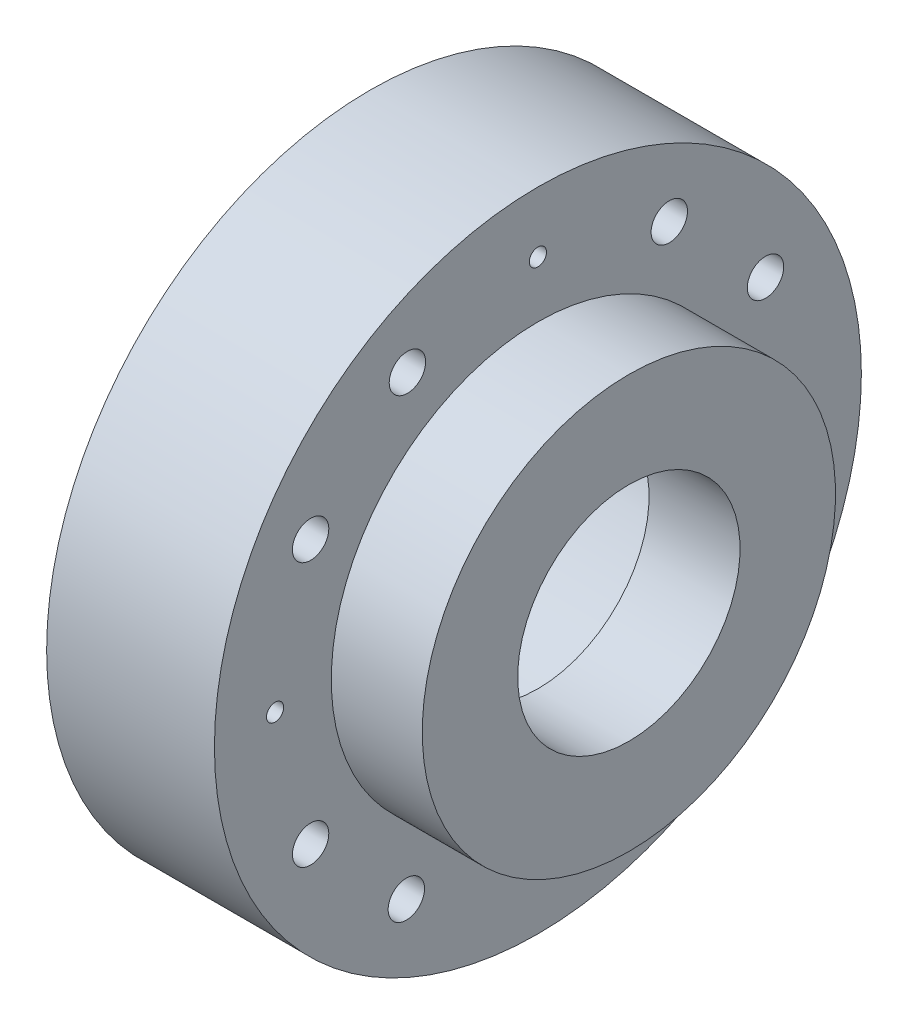
from build123d import *

# Parameters (mm, degrees)
ESQUISSE2_R             = 55
ENL_V_MAT_EXTRU_1_DEPTH = 242.016596939
TROU_TARAUD_M1010_D     = 8.5
PER_AGE16_D             = 18
PER_AGE16_DEPTH         = 90
PER_AGE16_CBORE_D       = 25
PER_AGE16_CBORE_DEPTH   = 40
PER_AGE17_D             = 18
PER_AGE17_DEPTH         = 90
PER_AGE17_CBORE_D       = 25
PER_AGE17_CBORE_DEPTH   = 40


with BuildPart() as part:
    # Esquisse1 → Révolution1 (revolve)
    with BuildSketch(Plane.XY, mode=Mode.PRIVATE) as r_volution1_sk:
        Polygon((0, 0), (0, 102.2), (-45, 102.2), (-45, 160), (-128, 160), (-128, 148.5), (-111, 148.5), (-111, 100), (-58, 100), (-58, 75), (-45, 75), (-45, 0), align=None)
    revolve(r_volution1_sk.sketch.rotate(Axis((-45, 0, 0), (1, 0, 0)), 180), axis=Axis((-45, 0, 0), (1, 0, 0)))

    # Esquisse2 → Enlèv. mat.-Extru.1 (cut, through all)
    with BuildSketch(Plane.ZY.offset(45)):
        with Locations(Location((0, 0, 0), (0, 0, 270))):
            Circle(ESQUISSE2_R)
    extrude(amount=-ENL_V_MAT_EXTRU_1_DEPTH, mode=Mode.SUBTRACT)

    # Trou taraudé M1010 (through all)
    with Locations(Plane(origin=(-111, 0, -130), x_dir=(0, -1, 0), z_dir=(-1, 0, 0))):
        with Locations((0, 0), (130, 130), (0, 260), (-130, 130)):
            Hole(TROU_TARAUD_M1010_D / 2)

    # Perçage16
    with Locations(Plane(origin=(-111, 65, -112.583302492), x_dir=(0, -1, 0), z_dir=(-1, 0, 0))):
        with Locations((0, 0), (-47.583302492, 47.583302492)):
            CounterBoreHole(PER_AGE16_D / 2, PER_AGE16_CBORE_D / 2, PER_AGE16_CBORE_DEPTH, depth=PER_AGE16_DEPTH)

    # Perçage17
    with Locations(Plane(origin=(-111, 112.844971207, 64.544654878), x_dir=(0, -1, 0), z_dir=(-1, 0, 0))):
        with Locations((0, 0), (47.582560607, 47.88673648), (178.107381807, 47.88673648), (225.386921388, 0.526916867), (225.468167625, -129.475507548), (177.582207006, -177.279256049)):
            CounterBoreHole(PER_AGE17_D / 2, PER_AGE17_CBORE_D / 2, PER_AGE17_CBORE_DEPTH, depth=PER_AGE17_DEPTH)


solid = part.part
